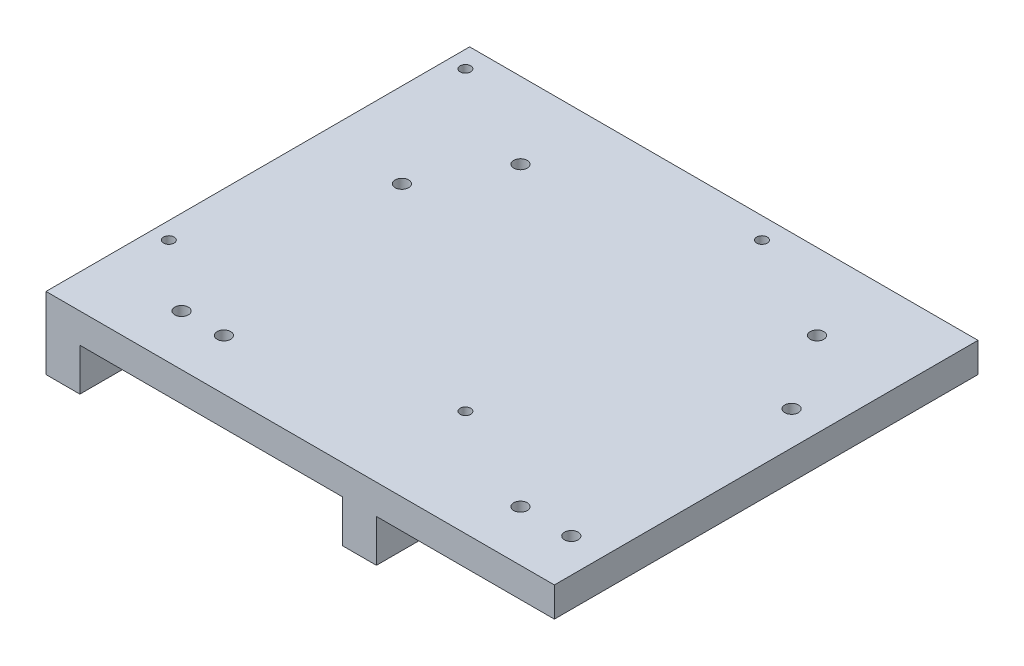
from build123d import *

# Parameters (mm, degrees)
SKETCH_1_W                   = 120
SKETCH_1_H                   = 100
EXTRUDE_1_DEPTH              = 7
SKETCH_2_R                   = 2.8
CUT_EXTRUDE_1_DEPTH          = 4
CUT_EXTRUDE_2_REACH          = 88.116
SKETCH_3_R                   = 1.6
SKETCH_4_W                   = 8
SKETCH_4_H                   = 100
EXTRUDE_2_DEPTH              = 10
HOLE_WIZARD_M3_5_D           = 2.5
HOLE_WIZARD_M3_5_CSINK_D     = 3.05
HOLE_WIZARD_M3_5_CSINK_ANGLE = 90


with BuildPart() as part:
    # 草图1 → 凸台-拉伸1 (new body)
    with BuildSketch(Plane(origin=(0, 0, 0), x_dir=(1, 0, 0), z_dir=(0, 1, 0))):
        with Locations((10, 0)):
            Rectangle(SKETCH_1_W, SKETCH_1_H)
    extrude(amount=EXTRUDE_1_DEPTH)

    # 草图2 → 切除-拉伸1 (cut)
    with BuildSketch(Plane.XZ):
        with Locations(Location((62, 38, 0), (0, 0, 270))):
            Circle(SKETCH_2_R)
        with Locations(Location((-30, 38, 0), (0, 0, 270))):
            Circle(SKETCH_2_R)
        with Locations(Location((-30, -14, 0), (0, 0, 270))):
            Circle(SKETCH_2_R)
        with Locations(Location((62, -14, 0), (0, 0, 270))):
            Circle(SKETCH_2_R)
        with Locations(Location((-20, 38, 0), (0, 0, 270))):
            Circle(SKETCH_2_R)
        with Locations(Location((50, 38, 0), (0, 0, 270))):
            Circle(SKETCH_2_R)
        with Locations(Location((50, -32, 0), (0, 0, 270))):
            Circle(SKETCH_2_R)
        with Locations(Location((-20, -32, 0), (0, 0, 270))):
            Circle(SKETCH_2_R)
    extrude(amount=-CUT_EXTRUDE_1_DEPTH, mode=Mode.SUBTRACT)

    # 草图3 → 切除-拉伸2 (cut, up to next)
    with BuildSketch(Plane.XZ.offset(-4), mode=Mode.PRIVATE) as cut_extrude_2_sk1:
        with Locations(Location((62, 38, 0), (0, 0, 270))):
            Circle(SKETCH_3_R)
    cut_extrude_2_tool1 = extrude(cut_extrude_2_sk1.sketch, amount=-CUT_EXTRUDE_2_REACH, mode=Mode.PRIVATE) & part.part
    # 草图3 → 切除-拉伸2 (cut, up to next)
    with BuildSketch(Plane.XZ.offset(-4), mode=Mode.PRIVATE) as cut_extrude_2_sk2:
        with Locations(Location((-30, 38, 0), (0, 0, 270))):
            Circle(SKETCH_3_R)
    cut_extrude_2_tool2 = extrude(cut_extrude_2_sk2.sketch, amount=-CUT_EXTRUDE_2_REACH, mode=Mode.PRIVATE) & part.part
    # 草图3 → 切除-拉伸2 (cut, up to next)
    with BuildSketch(Plane.XZ.offset(-4), mode=Mode.PRIVATE) as cut_extrude_2_sk3:
        with Locations(Location((-30, -14, 0), (0, 0, 270))):
            Circle(SKETCH_3_R)
    cut_extrude_2_tool3 = extrude(cut_extrude_2_sk3.sketch, amount=-CUT_EXTRUDE_2_REACH, mode=Mode.PRIVATE) & part.part
    # 草图3 → 切除-拉伸2 (cut, up to next)
    with BuildSketch(Plane.XZ.offset(-4), mode=Mode.PRIVATE) as cut_extrude_2_sk4:
        with Locations(Location((62, -14, 0), (0, 0, 270))):
            Circle(SKETCH_3_R)
    cut_extrude_2_tool4 = extrude(cut_extrude_2_sk4.sketch, amount=-CUT_EXTRUDE_2_REACH, mode=Mode.PRIVATE) & part.part
    # 草图3 → 切除-拉伸2 (cut, up to next)
    with BuildSketch(Plane.XZ.offset(-4), mode=Mode.PRIVATE) as cut_extrude_2_sk5:
        with Locations(Location((-20, 38, 0), (0, 0, 270))):
            Circle(SKETCH_3_R)
    cut_extrude_2_tool5 = extrude(cut_extrude_2_sk5.sketch, amount=-CUT_EXTRUDE_2_REACH, mode=Mode.PRIVATE) & part.part
    # 草图3 → 切除-拉伸2 (cut, up to next)
    with BuildSketch(Plane.XZ.offset(-4), mode=Mode.PRIVATE) as cut_extrude_2_sk6:
        with Locations(Location((50, 38, 0), (0, 0, 270))):
            Circle(SKETCH_3_R)
    cut_extrude_2_tool6 = extrude(cut_extrude_2_sk6.sketch, amount=-CUT_EXTRUDE_2_REACH, mode=Mode.PRIVATE) & part.part
    # 草图3 → 切除-拉伸2 (cut, up to next)
    with BuildSketch(Plane.XZ.offset(-4), mode=Mode.PRIVATE) as cut_extrude_2_sk7:
        with Locations(Location((50, -32, 0), (0, 0, 270))):
            Circle(SKETCH_3_R)
    cut_extrude_2_tool7 = extrude(cut_extrude_2_sk7.sketch, amount=-CUT_EXTRUDE_2_REACH, mode=Mode.PRIVATE) & part.part
    # 草图3 → 切除-拉伸2 (cut, up to next)
    with BuildSketch(Plane.XZ.offset(-4), mode=Mode.PRIVATE) as cut_extrude_2_sk8:
        with Locations(Location((-20, -32, 0), (0, 0, 270))):
            Circle(SKETCH_3_R)
    cut_extrude_2_tool8 = extrude(cut_extrude_2_sk8.sketch, amount=-CUT_EXTRUDE_2_REACH, mode=Mode.PRIVATE) & part.part
    add(cut_extrude_2_tool1.solids().sort_by_distance((62, 4, 38))[0], mode=Mode.SUBTRACT)
    add(cut_extrude_2_tool2.solids().sort_by_distance((-30, 4, 38))[0], mode=Mode.SUBTRACT)
    add(cut_extrude_2_tool3.solids().sort_by_distance((-30, 4, -14))[0], mode=Mode.SUBTRACT)
    add(cut_extrude_2_tool4.solids().sort_by_distance((62, 4, -14))[0], mode=Mode.SUBTRACT)
    add(cut_extrude_2_tool5.solids().sort_by_distance((-20, 4, 38))[0], mode=Mode.SUBTRACT)
    add(cut_extrude_2_tool6.solids().sort_by_distance((50, 4, 38))[0], mode=Mode.SUBTRACT)
    add(cut_extrude_2_tool7.solids().sort_by_distance((50, 4, -32))[0], mode=Mode.SUBTRACT)
    add(cut_extrude_2_tool8.solids().sort_by_distance((-20, 4, -32))[0], mode=Mode.SUBTRACT)

    # 草图4 → 凸台-拉伸2 (add)
    with BuildSketch(Plane.XZ):
        with Locations((-46, 0)):
            Rectangle(SKETCH_4_W, SKETCH_4_H)
        with Locations((24, 0)):
            Rectangle(SKETCH_4_W, SKETCH_4_H)
    extrude(amount=EXTRUDE_2_DEPTH)

    # M3 螺纹孔5 (through all)
    with Locations(Plane.XZ.offset(10)):
        with Locations((-46, -45), (24, -45), (24, 25), (-46, 25)):
            CounterSinkHole(HOLE_WIZARD_M3_5_D / 2, HOLE_WIZARD_M3_5_CSINK_D / 2, counter_sink_angle=HOLE_WIZARD_M3_5_CSINK_ANGLE)


solid = part.part
